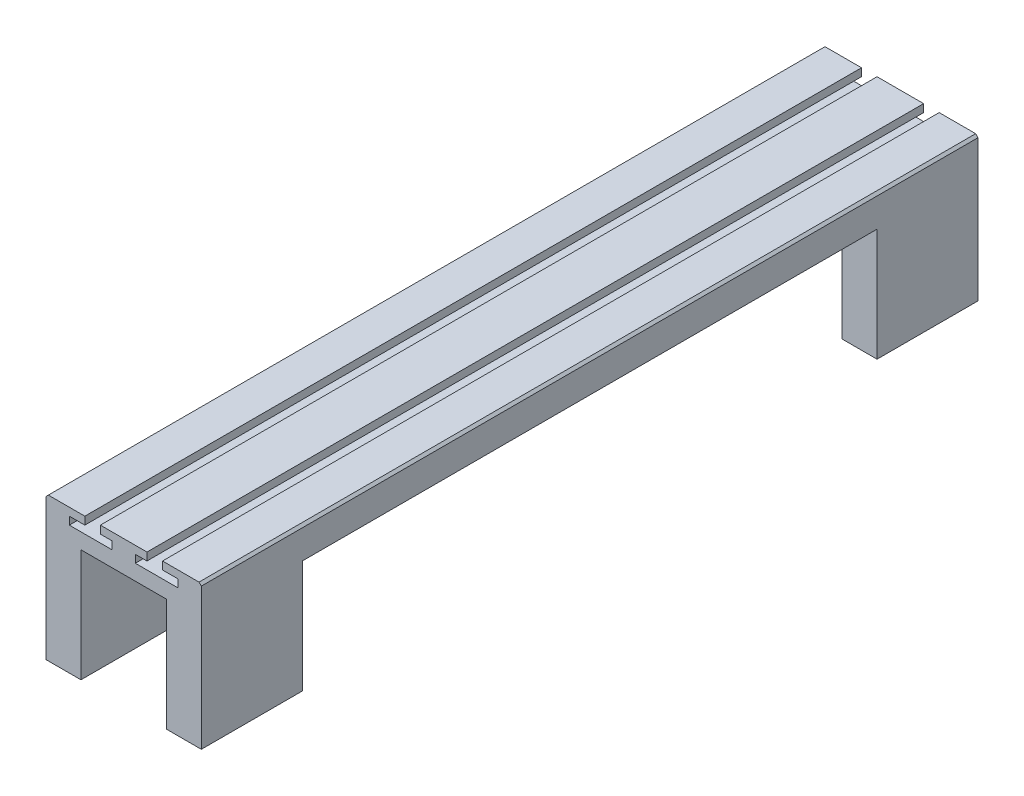
from build123d import *

# Parameters (mm, degrees)
BOSS_EXTRUDE1_DEPTH = 1000
SKETCH2_W           = 45
SKETCH2_H           = 130
BOSS_EXTRUDE2_DEPTH = 145
CHAMFER1_SIZE       = 3


with BuildPart() as part:
    # Sketch1 → Boss-Extrude1 (new body)
    with BuildSketch(Plane.XY):
        Polygon((-8.548454956, 0), (-50, 0), (-50, -40), (150, -40), (150, 0), (131.451545044, 0), (100, 0), (100, -10), (120, -10), (120, -20), (65, -20), (65, -10), (80, -10), (80, 0), (77.428634929, 0), (47.428634929, 0), (20, 0), (20, -10), (35, -10), (35, -20), (-20, -20), (-20, -10), (0, -10), (0, 0), align=None)
    extrude(amount=BOSS_EXTRUDE1_DEPTH)

    # Sketch2 → Boss-Extrude2 (add)
    with BuildSketch(Plane.XZ.offset(40)):
        with Locations((127.5, 935)):
            Rectangle(SKETCH2_W, SKETCH2_H)
        with Locations((-27.5, 935)):
            Rectangle(SKETCH2_W, SKETCH2_H)
        with Locations((127.5, 65)):
            Rectangle(SKETCH2_W, SKETCH2_H)
        with Locations((-27.5, 65)):
            Rectangle(SKETCH2_W, SKETCH2_H)
    extrude(amount=BOSS_EXTRUDE2_DEPTH)

    # Chamfer1
    chamfer1_edges = [part.edges().sort_by_distance(p)[0] for p in [
        (150, 0, 500),
        (-50, 0, 500),
    ]]
    chamfer(chamfer1_edges, length=CHAMFER1_SIZE)


solid = part.part
